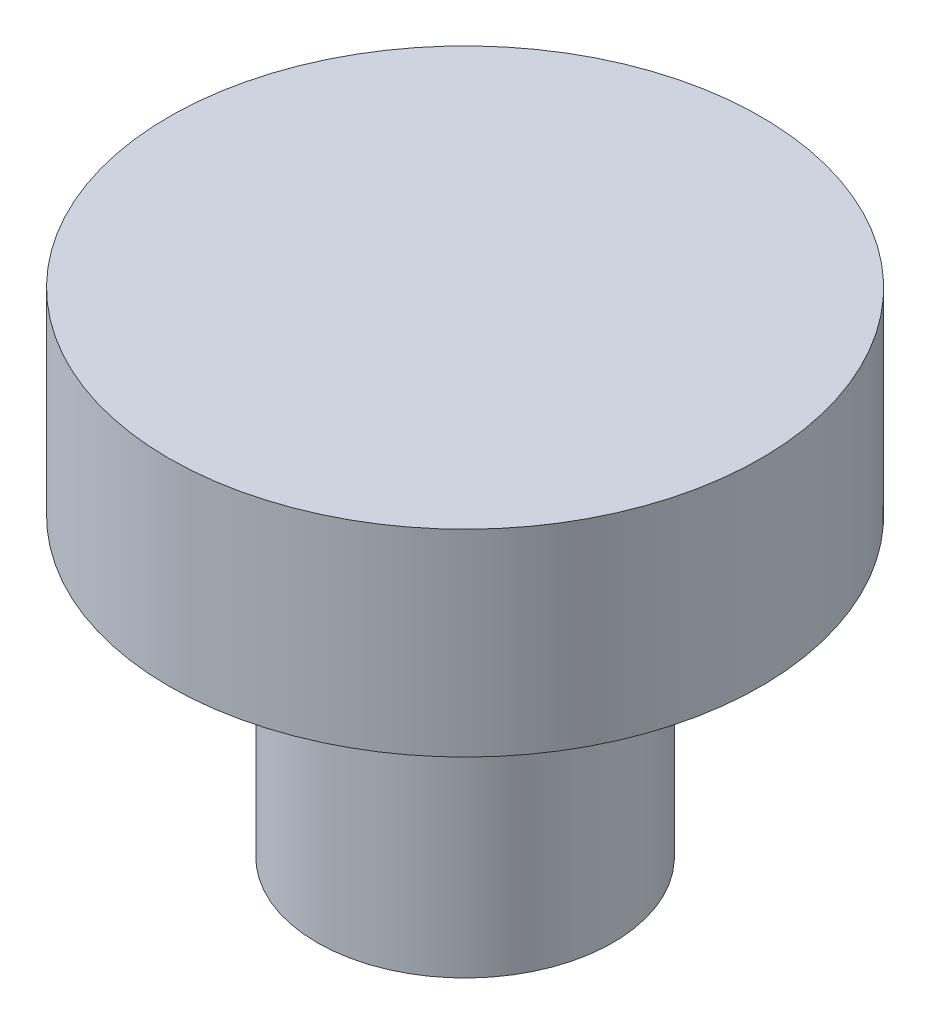
from build123d import *

# Parameters (mm, degrees)
SKETCH1_R           = 1.5
BOSS_EXTRUDE1_DEPTH = 3
SKETCH2_R           = 3
BOSS_EXTRUDE2_DEPTH = 2


with BuildPart() as part:
    # Sketch1 → Boss-Extrude1 (new body)
    with BuildSketch(Plane(origin=(0, 0, 0), x_dir=(1, 0, 0), z_dir=(0, 1, 0))):
        with Locations(Location((0, 0, 0), (0, 0, 270))):
            Circle(SKETCH1_R)
    extrude(amount=BOSS_EXTRUDE1_DEPTH)

    # Sketch2 → Boss-Extrude2 (add)
    with BuildSketch(Plane(origin=(0, 3, 0), x_dir=(1, 0, 0), z_dir=(0, 1, 0))):
        with Locations(Location((0, 0, 0), (0, 0, 270))):
            Circle(SKETCH2_R)
    extrude(amount=BOSS_EXTRUDE2_DEPTH)


solid = part.part
